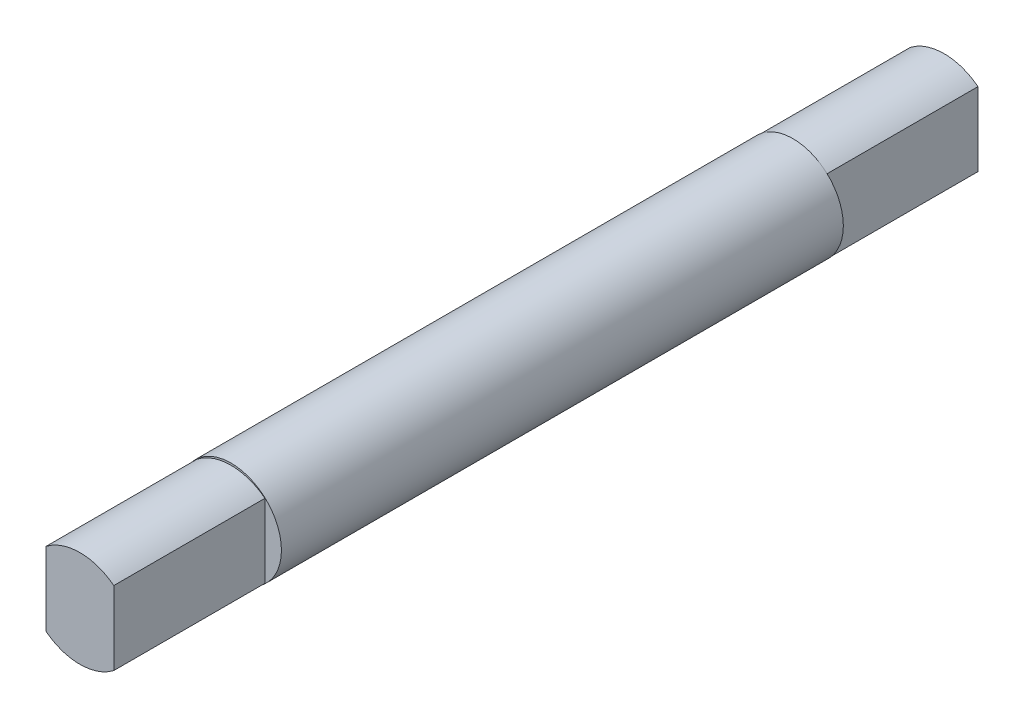
from build123d import *

# Parameters (mm, degrees)
SKETCH_1_W      = 2.6
SKETCH_1_H      = 14.5
EXTRUDE_1_DEPTH = 7.8


with BuildPart() as part:
    # 草图1 → 旋转1 (revolve)
    with BuildSketch(Plane(origin=(0, 0, 0), x_dir=(1, 0, 0), z_dir=(0, 1, 0))):
        with Locations((1.3, 7.25)):
            Rectangle(SKETCH_1_W, SKETCH_1_H)
    revolve(axis=Axis((0, 0, 0), (0, 0, -1)))

    # 草图2 → 凸台-拉伸1 (add)
    with BuildSketch(Plane.XY):
        with BuildLine():
            Line((-1.75, 1.9), (-1.75, -1.9))
            ThreePointArc((-1.75, -1.9), (0, -2.5), (1.75, -1.9))
            Line((1.75, -1.9), (1.75, 1.9))
            ThreePointArc((1.75, 1.9), (0, 2.5), (-1.75, 1.9))
        make_face()
    extrude(amount=EXTRUDE_1_DEPTH)

    # 镜向1: part across plane


with BuildPart() as part_1:
    add(part.part)
    add(part.part.mirror(Plane(origin=(0, 0, -14.5), x_dir=(1, 0, 0), z_dir=(0, 0, -1))))


solid = part_1.part
